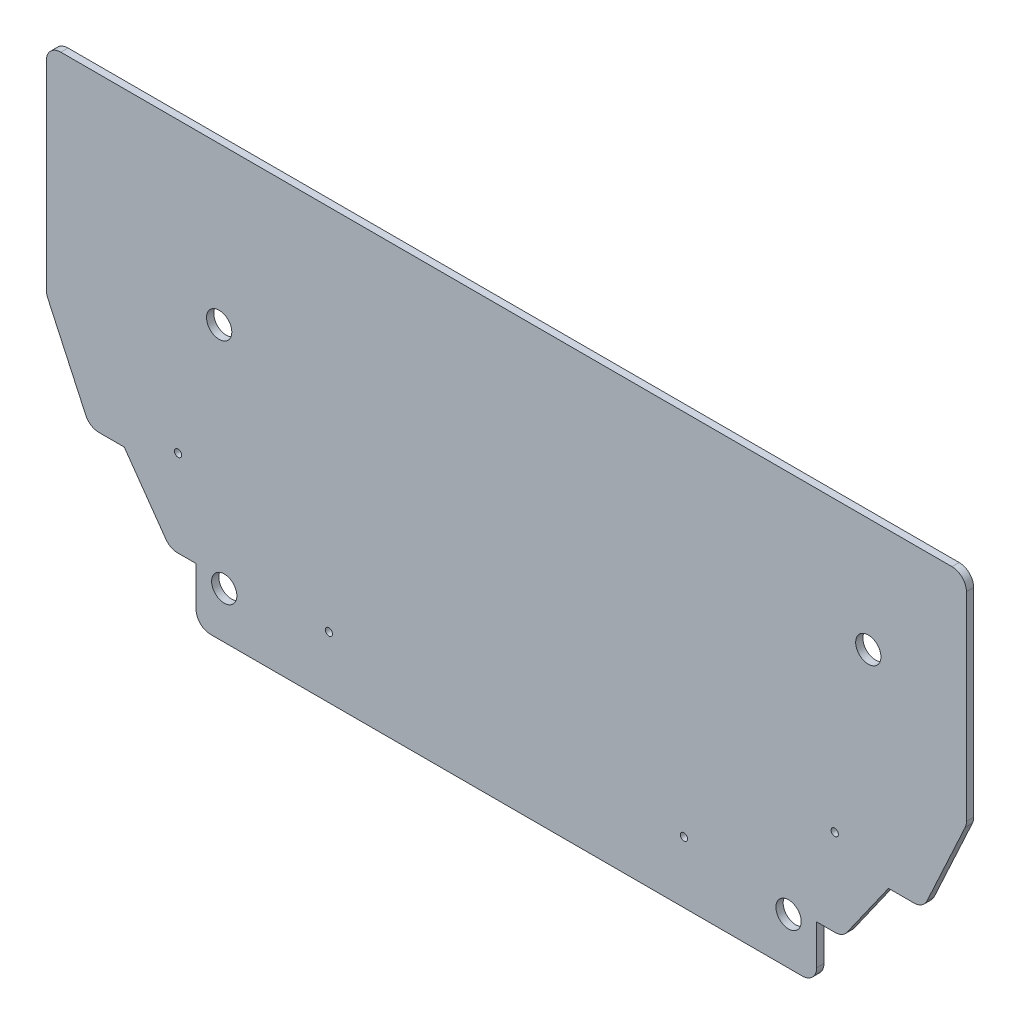
from build123d import *

# Parameters (mm, degrees)
ESQUISSE1_W             = 127.5
ESQUISSE1_H             = 59.5
BOSS_EXTRU_1_DEPTH      = 1
ESQUISSE3_R             = 1.75
ENL_V_MAT_EXTRU_1_DEPTH = 141.703589151
ESQUISSE5_R             = 0.5
ENL_V_MAT_EXTRU_3_DEPTH = 141.703589151
CONG_1_R                = 2


with BuildPart() as part:
    # Esquisse1 → Boss.-Extru.1 (new body)
    with BuildSketch(Plane.XY):
        with Locations((63.75, 29.75)):
            Rectangle(ESQUISSE1_W, ESQUISSE1_H)
    extrude(amount=BOSS_EXTRU_1_DEPTH)

    # Esquisse3 → Enlèv. mat.-Extru.1 (cut, through all)
    with BuildSketch(Plane.XY.offset(1)):
        with Locations((102.85, 6.45)):
            Circle(ESQUISSE3_R)
        with Locations((113.9, 43.75)):
            Circle(ESQUISSE3_R)
        with Locations((23.95, 37.75)):
            Circle(ESQUISSE3_R)
        with Locations((24.65, 6.45)):
            Circle(ESQUISSE3_R)
        Polygon((127.5, 29.5), (121.5, 16.5), (116.7, 16.5), (110.35, 7.5), (106.75, 7.5), (106.75, 0), (127.5, 0), align=None)
        Polygon((0, 0), (20.75, 0), (20.75, 7.5), (17.15, 7.5), (10.8, 16.5), (6, 16.5), (0, 29.5), align=None)
    extrude(amount=-ENL_V_MAT_EXTRU_1_DEPTH, mode=Mode.SUBTRACT)

    # Esquisse5 → Enlèv. mat.-Extru.3 (cut, through all)
    with BuildSketch(Plane.XY.offset(1)):
        with Locations((39.15, 8.5)):
            Circle(ESQUISSE5_R)
        with Locations((88.35, 8.5)):
            Circle(ESQUISSE5_R)
        with Locations((109.25, 19.5)):
            Circle(ESQUISSE5_R)
        with Locations((18.25, 19.5)):
            Circle(ESQUISSE5_R)
    extrude(amount=-ENL_V_MAT_EXTRU_3_DEPTH, mode=Mode.SUBTRACT)

    # Congé1
    cong_1_edges = [part.edges().sort_by_distance(p)[0] for p in [
        (127.5, 29.5, 0.5),
        (106.75, 0, 0.5),
        (110.35, 7.5, 0.5),
        (121.5, 16.5, 0.5),
        (0, 29.5, 0.5),
        (6, 16.5, 0.5),
        (17.15, 7.5, 0.5),
        (20.75, 0, 0.5),
        (0, 59.5, 0.5),
        (127.5, 59.5, 0.5),
    ]]
    fillet(cong_1_edges, radius=CONG_1_R)


solid = part.part
